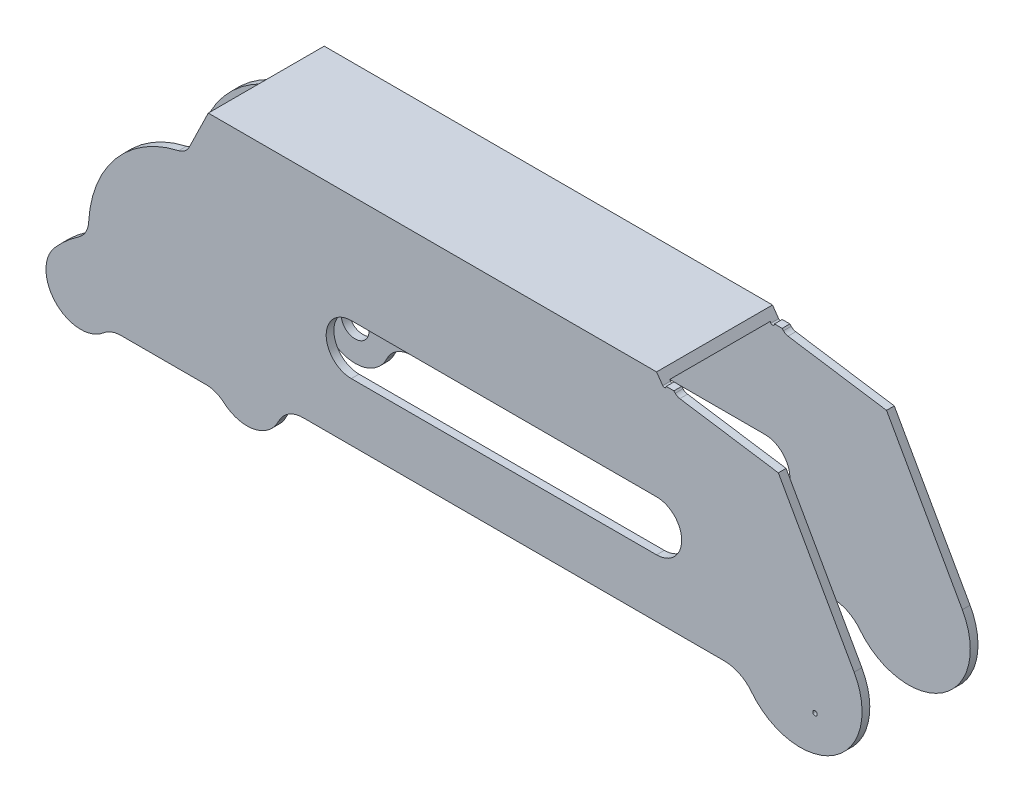
from build123d import *

# Parameters (mm, degrees)
BOSS_EXTRUDE1_DEPTH = 2
BOSS_EXTRUDE2_DEPTH = 26
BOSS_EXTRUDE3_START = 2
BOSS_EXTRUDE3_DEPTH = 2
CUT_EXTRUDE1_REACH  = 138.664
CUT_EXTRUDE2_DEPTH  = 137.663822213
HOLE1_D             = 1.156713631
HOLE1_DEPTH         = 2
HOLE2_D             = 7.232882037
HOLE2_DEPTH         = 2
FILLET1_R           = 2
FILLET2_R           = 4
FILLET3_R           = 6
FILLET4_R           = 7
FILLET5_R           = 9


with BuildPart() as part:
    # Sketch1 → Boss-Extrude1 (new body)
    with BuildSketch(Plane.XY.offset(-13)):
        with BuildLine():
            Line((38.589514728, 53.714517423), (38.390964743, 54.000002708))
            Line((38.390964743, 54.000002708), (37, 56.000002696))
            Line((37, 56.000002696), (-79, 56.000002696))
            Line((-79, 56.000002696), (-84.797547627, 44.113268525))
            ThreePointArc((-84.797547627, 44.113268525), (-103.30638504, 33.384611029), (-109.961112948, 13.052475123))
            ThreePointArc((-109.961112948, 13.052475123), (-114.714513302, 9.85906483), (-118.822624433, 5.869565217))
            ThreePointArc((-118.822624433, 5.869565217), (-117.511822587, -7.114760135), (-104.611841725, -5.139563921))
            Line((-104.611841725, -5.139563921), (-76.511157838, -5.139563921))
            ThreePointArc((-76.511157838, -5.139563921), (-66.310042494, -8.694638462), (-59.898757812, 0))
            Line((-59.898757812, 0), (59.520798297, 0))
            ThreePointArc((59.520798297, 0), (81.317661031, -7.891849144), (88.119135563, 14.269478708))
            Line((88.119135563, 14.269478708), (68.507754464, 49.131976199))
            Line((68.507754464, 49.131976199), (42.308532947, 53.113281503))
            Line((42.308532947, 53.113281503), (41.5, 54.000002696))
            Line((41.5, 54.000002696), (39.5, 54.000002696))
            ThreePointArc((39.5, 54.000002696), (39.14959506, 53.522905936), (38.589514728, 53.714517423))
        make_face()
    extrude(amount=-BOSS_EXTRUDE1_DEPTH)

    # Sketch2 → Boss-Extrude2 (add)
    with BuildSketch(Plane.XY.offset(-13)):
        Polygon((37, 56.000002696), (38.390964806, 54.000002752), (-79.97546515, 54.000002752), (-79, 56.000002696), align=None)
    extrude(amount=BOSS_EXTRUDE2_DEPTH)

    # Sketch3 → Boss-Extrude3 (add)
    with BuildSketch(Plane.XY.offset(13).offset(BOSS_EXTRUDE3_START)):
        with BuildLine():
            Line((39.500000002, 54.000002689), (41.499999991, 54.000002689))
            Line((41.499999991, 54.000002689), (42.308532938, 53.113281497))
            Line((42.308532938, 53.113281497), (68.507754455, 49.131976193))
            Line((68.507754455, 49.131976193), (88.119135607, 14.269478608))
            ThreePointArc((88.119135607, 14.269478608), (81.317661026, -7.891849269), (59.520798297, 0))
            Line((59.520798297, 0), (-59.898757812, 0))
            ThreePointArc((-59.898757812, 0), (-66.310042494, -8.694638462), (-76.511157838, -5.139563921))
            Line((-76.511157838, -5.139563921), (-104.611841725, -5.139563921))
            ThreePointArc((-104.611841725, -5.139563921), (-117.511822587, -7.114760135), (-118.822624433, 5.869565217))
            ThreePointArc((-118.822624433, 5.869565217), (-114.714513302, 9.85906483), (-109.961112948, 13.052475123))
            ThreePointArc((-109.961112948, 13.052475123), (-103.30638504, 33.384611029), (-84.797547627, 44.113268525))
            Line((-84.797547627, 44.113268525), (-79, 56.000002696))
            Line((-79, 56.000002696), (37, 56.000002696))
            Line((37, 56.000002696), (38.589345234, 53.714761246))
            ThreePointArc((38.589345234, 53.714761246), (39.149453375, 53.522861518), (39.500000002, 54.000002689))
        make_face()
    extrude(amount=-BOSS_EXTRUDE3_DEPTH)

    # Sketch4 → Cut-Extrude1 (cut, up to next)
    with BuildSketch(Plane(origin=(0, 0, -15), x_dir=(-1, 0, 0), z_dir=(0, 0, -1)), mode=Mode.PRIVATE) as cut_extrude1_sk1:
        with BuildLine():
            Line((-37, 14.999963704), (42, 14.999963704))
            ThreePointArc((42, 14.999963704), (48.5, 21.499963704), (42, 27.999963704))
            Line((42, 27.999963704), (-37, 27.999963704))
            ThreePointArc((-37, 27.999963704), (-43.5, 21.499963704), (-37, 14.999963704))
        make_face()
    cut_extrude1_tool1 = extrude(cut_extrude1_sk1.sketch, amount=-CUT_EXTRUDE1_REACH, mode=Mode.PRIVATE) & part.part
    add(cut_extrude1_tool1.solids().sort_by_distance((-2.5, 21.499964, -15))[0], mode=Mode.SUBTRACT)

    # Sketch5 → Cut-Extrude2 (cut, through all)
    with BuildSketch(Plane.XY.offset(15)):
        with BuildLine():
            Line((37, 27.999963704), (-42, 27.999963704))
            ThreePointArc((-42, 27.999963704), (-48.5, 21.499963704), (-42, 14.999963704))
            Line((-42, 14.999963704), (37, 14.999963704))
            ThreePointArc((37, 14.999963704), (43.5, 21.499963704), (37, 27.999963704))
        make_face()
    extrude(amount=-CUT_EXTRUDE2_DEPTH, mode=Mode.SUBTRACT)

    # Hole1
    with Locations(Plane(origin=(0, 0, 13), x_dir=(-1, 0, 0), z_dir=(0, 0, -1))):
        with Locations((-78.000162744, 0)):
            Hole(HOLE1_D / 2, depth=HOLE1_DEPTH)

    # Hole2
    with Locations(Plane.XY.offset(-13)):
        with Locations((-69, 0)):
            Hole(HOLE2_D / 2, depth=HOLE2_DEPTH)

    # Fillet1
    fillet1_edges = [part.edges().sort_by_distance(p)[0] for p in [
        (42.308532947, 53.113281503, -14),
        (42.308532938, 53.113281497, 14),
    ]]
    fillet(fillet1_edges, radius=FILLET1_R)

    # Fillet2
    fillet2_edges = [part.edges().sort_by_distance(p)[0] for p in [
        (-84.797547627, 44.113268525, -14),
        (-84.797547627, 44.113268525, 14),
    ]]
    fillet(fillet2_edges, radius=FILLET2_R)

    # Fillet3
    fillet3_edges = [part.edges().sort_by_distance(p)[0] for p in [
        (-109.961112948, 13.052475123, -14),
        (-109.961112948, 13.052475123, 14),
    ]]
    fillet(fillet3_edges, radius=FILLET3_R)

    # Fillet4
    fillet4_edges = [part.edges().sort_by_distance(p)[0] for p in [
        (-59.898757812, 0, -14),
        (-76.511157838, -5.139563921, -14),
        (-104.611841725, -5.139563921, -14),
        (-104.611841725, -5.139563921, 14),
        (-76.511157838, -5.139563921, 14),
        (-59.898757812, 0, 14),
    ]]
    fillet(fillet4_edges, radius=FILLET4_R)

    # Fillet5
    fillet5_edges = [part.edges().sort_by_distance(p)[0] for p in [
        (59.520798297, 0, -14),
        (59.520798297, 0, 14),
    ]]
    fillet(fillet5_edges, radius=FILLET5_R)


solid = part.part
